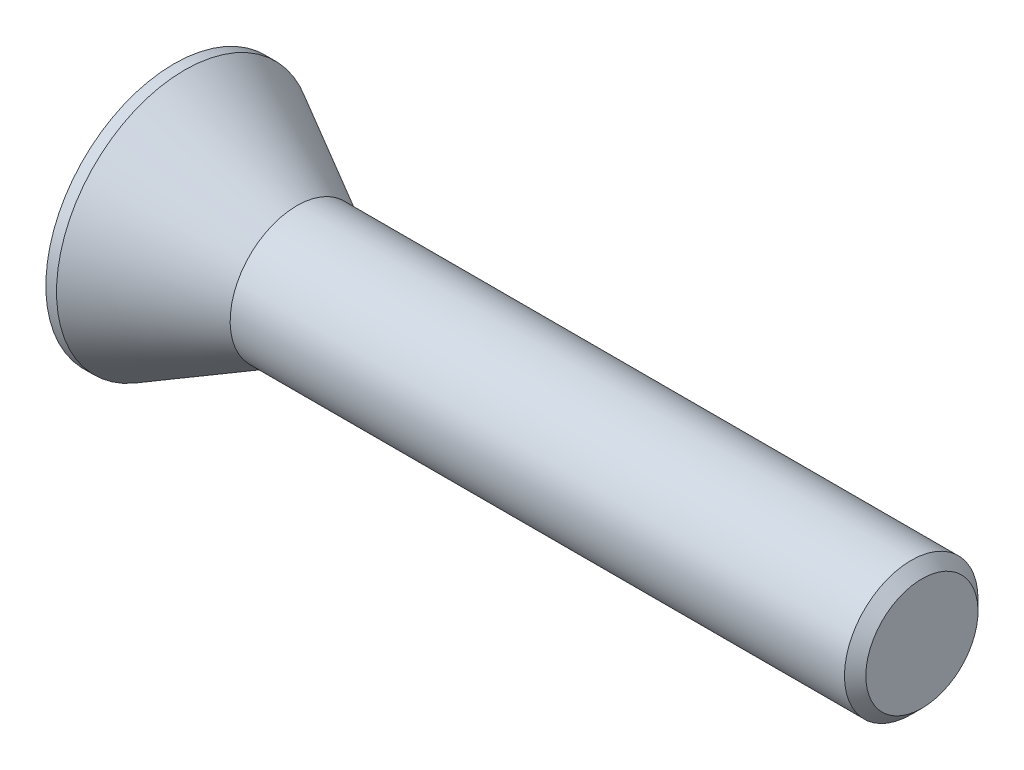
from build123d import *

# Parameters (mm, degrees)
CUT_EXTRUDE_1_DEPTH = 0.4
CHAMFER_1_SIZE      = 0.2


with BuildPart() as part:
    # 草图1 → 旋转1 (revolve)
    with BuildSketch(Plane.XY, mode=Mode.PRIVATE) as revolve_1_sk:
        Polygon((0, 0), (0, -2.4), (0.2, -2.4), (2.3, -1.25), (14, -1.25), (14, 0), align=None)
    revolve(revolve_1_sk.sketch.rotate(Axis((14, 0, 0), (-1, 0, 0)), 180), axis=Axis((14, 0, 0), (-1, 0, 0)))

    # 草图2 → 切除-拉伸1 (cut)
    with BuildSketch(Plane.ZY):
        Polygon((0.866025404, 0), (0.433012702, 0.75), (-0.433012702, 0.75), (-0.866025404, 0), (-0.433012702, -0.75), (0.433012702, -0.75), align=None)
    extrude(amount=-CUT_EXTRUDE_1_DEPTH, mode=Mode.SUBTRACT)

    # 倒角1
    chamfer_1_edges = [part.edges().sort_by_distance(p)[0] for p in [
        (14, -1.25, 0),
    ]]
    chamfer(chamfer_1_edges, length=CHAMFER_1_SIZE)


solid = part.part
